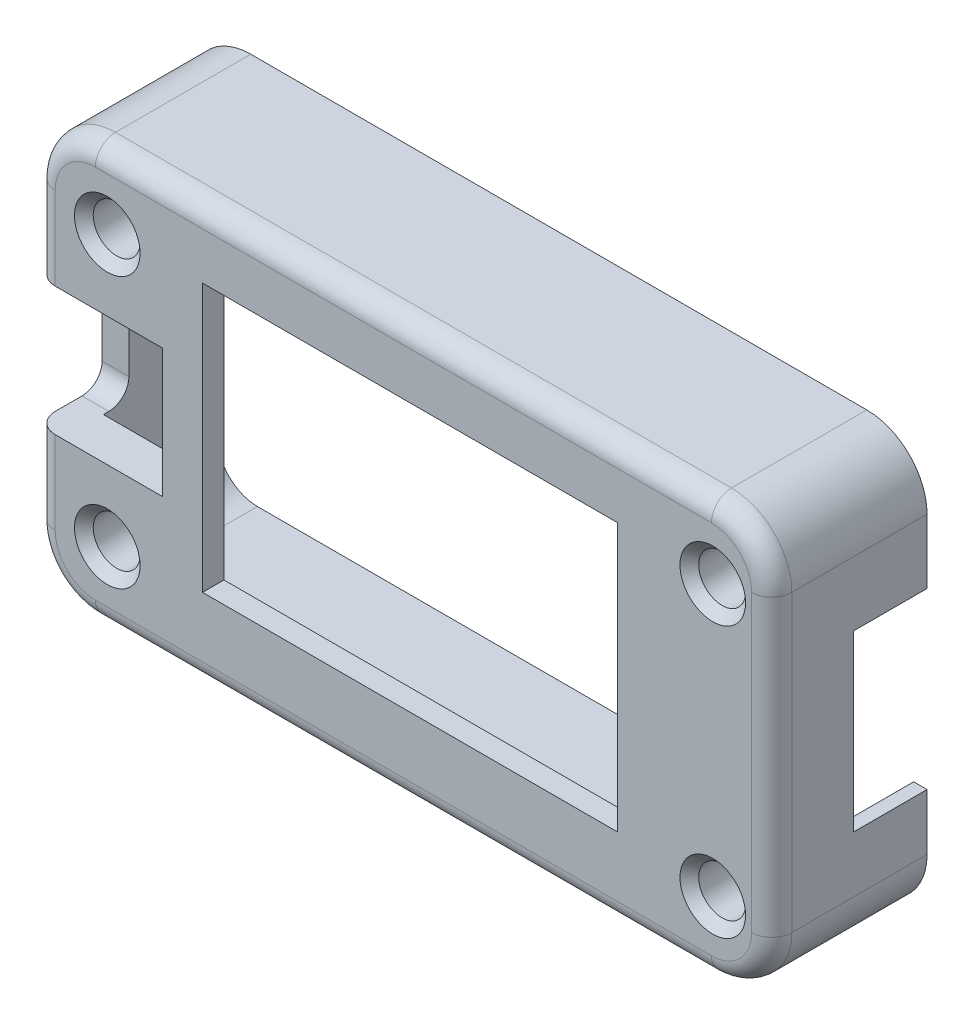
from build123d import *

# Parameters (mm, degrees)
SKETCH_1_W          = 55
SKETCH_1_H          = 31
SKETCH_1_W_2        = 52
SKETCH_1_H_2        = 27
EXTRUDE_1_DEPTH     = 10
SKETCH_2_W          = 55
SKETCH_2_H          = 31
EXTRUDE_2_DEPTH     = 1.6
CUT_EXTRUDE_1_REACH = 66.192
SKETCH_3_W          = 31
SKETCH_3_H          = 20
SKETCH_4_W          = 52
SKETCH_4_H          = 27
SKETCH_4_W_2        = 35
SKETCH_4_H_2        = 24
EXTRUDE_3_DEPTH     = 1.5
SKETCH_5_W          = 15
SKETCH_5_H          = 2
CUT_EXTRUDE_2_DEPTH = 1.5
SKETCH_7_W          = 9.5
SKETCH_7_H          = 9.6
CUT_EXTRUDE_4_DEPTH = 5
SKETCH_8_W          = 1
SKETCH_8_H          = 9.6
CUT_EXTRUDE_5_DEPTH = 1.5
SKETCH_9_W          = 1
SKETCH_9_H          = 13
CUT_EXTRUDE_6_DEPTH = 5.5
SKETCH_10_R         = 1.75
CUT_EXTRUDE_7_DEPTH = 64.704395453
FILLET_1_R          = 3
FILLET_2_R          = 4.5
FILLET_3_R          = 1.5
FILLET_4_R          = 1.5
CHAMFER_1_SIZE      = 0.7


with BuildPart() as part:
    # 草图1 → 凸台-拉伸1 (new body)
    with BuildSketch(Plane.XY):
        with Locations((27.5, -15.5)):
            Rectangle(SKETCH_1_W, SKETCH_1_H)
        with Locations((28, -15.5)):
            Rectangle(SKETCH_1_W_2, SKETCH_1_H_2, mode=Mode.SUBTRACT)
    extrude(amount=EXTRUDE_1_DEPTH)

    # 草图2 → 凸台-拉伸2 (add)
    with BuildSketch(Plane.XY.offset(10)):
        with Locations((27.5, -15.5)):
            Rectangle(SKETCH_2_W, SKETCH_2_H)
    extrude(amount=EXTRUDE_2_DEPTH)

    # 草图3 → 切除-拉伸1 (cut, up to next)
    with BuildSketch(Plane.XY.offset(11.6), mode=Mode.PRIVATE) as cut_extrude_1_sk1:
        with Locations((28, -15)):
            Rectangle(SKETCH_3_W, SKETCH_3_H)
    cut_extrude_1_tool1 = extrude(cut_extrude_1_sk1.sketch, amount=-CUT_EXTRUDE_1_REACH, mode=Mode.PRIVATE) & part.part
    add(cut_extrude_1_tool1.solids().sort_by_distance((28, -15, 11.6))[0], mode=Mode.SUBTRACT)

    # 草图4 → 凸台-拉伸3 (add)
    with BuildSketch(Plane(origin=(0, 0, 10), x_dir=(-1, 0, 0), z_dir=(0, 0, -1))):
        with Locations((-28, -15.5)):
            Rectangle(SKETCH_4_W, SKETCH_4_H)
        with Locations((-28, -15)):
            Rectangle(SKETCH_4_W_2, SKETCH_4_H_2, mode=Mode.SUBTRACT)
    extrude(amount=EXTRUDE_3_DEPTH)

    # 草图5 → 切除-拉伸2 (cut)
    with BuildSketch(Plane(origin=(0, 0, 8.5), x_dir=(-1, 0, 0), z_dir=(0, 0, -1))):
        with Locations((-28, -28)):
            Rectangle(SKETCH_5_W, SKETCH_5_H)
    extrude(amount=-CUT_EXTRUDE_2_DEPTH, mode=Mode.SUBTRACT)

    # 草图7 → 切除-拉伸4 (cut)
    with BuildSketch(Plane.XY.offset(11.6)):
        with Locations((4.75, -15.5)):
            Rectangle(SKETCH_7_W, SKETCH_7_H)
    extrude(amount=-CUT_EXTRUDE_4_DEPTH, mode=Mode.SUBTRACT)

    # 草图8 → 切除-拉伸5 (cut)
    with BuildSketch(Plane(origin=(0, 0, 8.5), x_dir=(-1, 0, 0), z_dir=(0, 0, -1))):
        with Locations((-10, -15.5)):
            Rectangle(SKETCH_8_W, SKETCH_8_H)
    extrude(amount=-CUT_EXTRUDE_5_DEPTH, mode=Mode.SUBTRACT)

    # 草图9 → 切除-拉伸6 (cut)
    with BuildSketch(Plane(origin=(0, 0, 0), x_dir=(-1, 0, 0), z_dir=(0, 0, -1))):
        with Locations((-54.5, -15.8)):
            Rectangle(SKETCH_9_W, SKETCH_9_H)
    extrude(amount=-CUT_EXTRUDE_6_DEPTH, mode=Mode.SUBTRACT)

    # 草图10 → 切除-拉伸7 (cut, through all)
    with BuildSketch(Plane(origin=(0, 0, 8.5), x_dir=(-1, 0, 0), z_dir=(0, 0, -1))):
        with Locations((-50.6, -5.4)):
            Circle(SKETCH_10_R)
        with Locations((-5.388, -5.4)):
            Circle(SKETCH_10_R)
        with Locations((-5.388, -25.6)):
            Circle(SKETCH_10_R)
        with Locations((-50.6, -25.6)):
            Circle(SKETCH_10_R)
    extrude(amount=-CUT_EXTRUDE_7_DEPTH, mode=Mode.SUBTRACT)

    # 圆角1
    fillet_1_edges = [part.edges().sort_by_distance(p)[0] for p in [
        (54, -2, 4.25),
        (2, -2, 4.25),
        (54, -29, 4.25),
        (2, -29, 4.25),
    ]]
    fillet(fillet_1_edges, radius=FILLET_1_R)

    # 圆角2
    fillet_2_edges = [part.edges().sort_by_distance(p)[0] for p in [
        (0, 0, 5.8),
        (55, 0, 5.8),
        (55, -31, 5.8),
        (0, -31, 5.8),
    ]]
    fillet(fillet_2_edges, radius=FILLET_2_R)

    # 圆角3
    fillet_3_edges = [part.edges().sort_by_distance(p)[0] for p in [
        (1, -10.7, 6.6),
        (1, -20.3, 6.6),
    ]]
    fillet(fillet_3_edges, radius=FILLET_3_R)

    # 圆角4
    fillet_4_edges = [part.edges().sort_by_distance(p)[0] for p in [
        (0, -7.6, 11.6),
        (27.5, 0, 11.6),
        (27.5, -31, 11.6),
        (55, -15.5, 11.6),
        (53.681980515, -1.318019485, 11.6),
        (53.681980515, -29.681980515, 11.6),
        (1.318019485, -29.681980515, 11.6),
        (1.318019485, -1.318019485, 11.6),
        (0, -23.4, 11.6),
    ]]
    fillet(fillet_4_edges, radius=FILLET_4_R)

    # 倒角1
    chamfer_1_edges = [part.edges().sort_by_distance(p)[0] for p in [
        (52.35, -25.6, 11.6),
        (7.138, -25.6, 11.6),
        (7.138, -5.4, 11.6),
        (52.35, -5.4, 11.6),
    ]]
    chamfer(chamfer_1_edges, length=CHAMFER_1_SIZE)


solid = part.part
